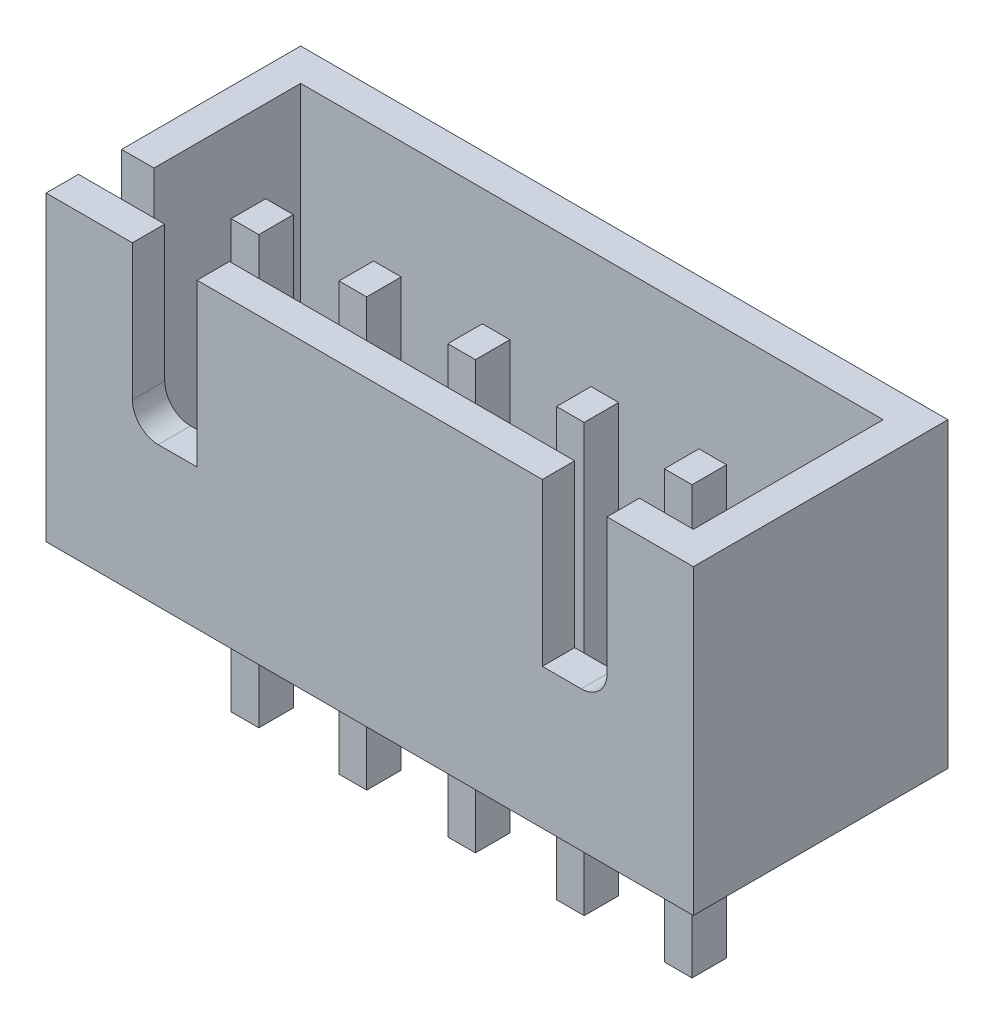
from build123d import *

# Parameters (mm, degrees)
CROQUIS1_W                   = 15
CROQUIS1_H                   = 5.9
CROQUIS1_W_2                 = 0.64
CROQUIS1_H_2                 = 0.8
SALIENTE_EXTRUIR1_DEPTH      = 1
CROQUIS2_W                   = 15
CROQUIS2_H                   = 5.9
CROQUIS2_W_2                 = 13.5
CROQUIS2_H_2                 = 4.4
SALIENTE_EXTRUIR2_DEPTH      = 6
CORTAR_EXTRUIR1_DEPTH        = 9
CORTAR_EXTRUIR2_DEPTH        = 2
SALIENTE_EXTRUIR3_DEPTH      = 6.5
SALIENTE_EXTRUIR3_DEPTH_BACK = 3.4
CROQUIS5_W                   = 0.64
CROQUIS5_H                   = 0.8


with BuildPart() as part:
    # Croquis1 → Saliente-Extruir1 (new body)
    with BuildSketch(Plane(origin=(0, 0, 0), x_dir=(1, 0, 0), z_dir=(0, 1, 0))):
        with Locations((5.02, 0.42)):
            Rectangle(CROQUIS1_W, CROQUIS1_H)
        Rectangle(CROQUIS1_W_2, CROQUIS1_H_2, mode=Mode.SUBTRACT)
        with Locations((10.04, 0)):
            Rectangle(CROQUIS1_W_2, CROQUIS1_H_2, mode=Mode.SUBTRACT)
        with Locations((7.54, 0)):
            Rectangle(CROQUIS1_W_2, CROQUIS1_H_2, mode=Mode.SUBTRACT)
        with Locations((2.5, 0)):
            Rectangle(CROQUIS1_W_2, CROQUIS1_H_2, mode=Mode.SUBTRACT)
        with Locations((5.02, 0)):
            Rectangle(CROQUIS1_W_2, CROQUIS1_H_2, mode=Mode.SUBTRACT)
    extrude(amount=SALIENTE_EXTRUIR1_DEPTH)

    # Croquis2 → Saliente-Extruir2 (add)
    with BuildSketch(Plane(origin=(0, 1, 0), x_dir=(1, 0, 0), z_dir=(0, 1, 0))):
        with Locations((5.02, 0.42)):
            Rectangle(CROQUIS2_W, CROQUIS2_H)
        with Locations((5.02, 0.42)):
            Rectangle(CROQUIS2_W_2, CROQUIS2_H_2, mode=Mode.SUBTRACT)
    extrude(amount=SALIENTE_EXTRUIR2_DEPTH)

    # Croquis3 → Cortar-Extruir1 (cut)
    with BuildSketch(Plane.ZY.offset(2.48)):
        with BuildLine():
            Line((1.78, 7), (1.78, 4.35))
            ThreePointArc((1.78, 4.35), (1.604264069, 3.925735931), (1.18, 3.75))
            Line((1.18, 3.75), (0.78, 3.75))
            Line((0.78, 3.75), (0.78, 7))
            Line((0.78, 7), (1.78, 7))
        make_face()
    extrude(amount=-CORTAR_EXTRUIR1_DEPTH, mode=Mode.SUBTRACT)

    # Croquis4 → Cortar-Extruir2 (cut)
    with BuildSketch(Plane.XY.offset(2.53)):
        with BuildLine():
            Line((-0.48, 7), (-0.48, 3.85))
            ThreePointArc((-0.48, 3.85), (-0.304264069, 3.425735931), (0.12, 3.25))
            Line((0.12, 3.25), (1.02, 3.25))
            Line((1.02, 3.25), (1.02, 7))
            Line((1.02, 7), (-0.48, 7))
        make_face()
        with BuildLine():
            Line((10.52, 7), (9.02, 7))
            Line((9.02, 7), (9.02, 3.25))
            Line((9.02, 3.25), (9.92, 3.25))
            ThreePointArc((9.92, 3.25), (10.344264069, 3.425735931), (10.52, 3.85))
            Line((10.52, 3.85), (10.52, 7))
        make_face()
    extrude(amount=-CORTAR_EXTRUIR2_DEPTH, mode=Mode.SUBTRACT)

    # Croquis5 → Saliente-Extruir3 (add, two sides: drawn at the far end of the back side and taken through both)
    with BuildSketch(Plane(origin=(0, 0, 0), x_dir=(1, 0, 0), z_dir=(0, 1, 0)).offset(-SALIENTE_EXTRUIR3_DEPTH_BACK)):
        with Locations((10.04, 0)):
            Rectangle(CROQUIS5_W, CROQUIS5_H)
        Rectangle(CROQUIS5_W, CROQUIS5_H)
        with Locations((2.5, 0)):
            Rectangle(CROQUIS5_W, CROQUIS5_H)
        with Locations((7.54, 0)):
            Rectangle(CROQUIS5_W, CROQUIS5_H)
        with Locations((5.02, 0)):
            Rectangle(CROQUIS5_W, CROQUIS5_H)
    extrude(amount=SALIENTE_EXTRUIR3_DEPTH + SALIENTE_EXTRUIR3_DEPTH_BACK)


solid = part.part
